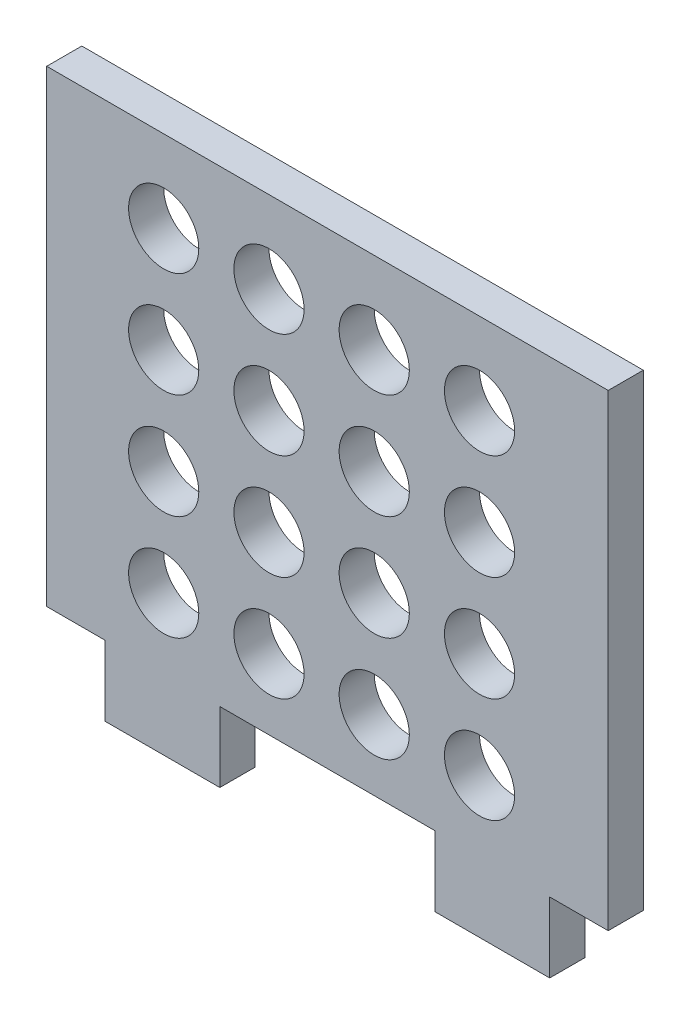
from build123d import *

# Parameters (mm, degrees)
ESQUISSE1_W             = 24
ESQUISSE1_H             = 20
BOSS_EXTRU_1_DEPTH      = 1.5
ESQUISSE2_W             = 4.9
ESQUISSE2_H             = 3
BOSS_EXTRU_2_DEPTH      = 1.5
ENL_V_MAT_EXTRU_1_REACH = 25.372
ESQUISSE3_R             = 1.5


with BuildPart() as part:
    # Esquisse1 → Boss.-Extru.1 (new body)
    with BuildSketch(Plane.XY):
        with Locations((0, 10)):
            Rectangle(ESQUISSE1_W, ESQUISSE1_H)
    extrude(amount=BOSS_EXTRU_1_DEPTH)

    # Esquisse2 → Boss.-Extru.2 (add)
    with BuildSketch(Plane.XY):
        with Locations((7.05, -1.5)):
            Rectangle(ESQUISSE2_W, ESQUISSE2_H)
        with Locations((-7.05, -1.5)):
            Rectangle(ESQUISSE2_W, ESQUISSE2_H)
    extrude(amount=BOSS_EXTRU_2_DEPTH)

    # Esquisse3 → Enlèv. mat.-Extru.1 (cut, up to next)
    with BuildSketch(Plane.XY.offset(1.5), mode=Mode.PRIVATE) as enl_v_mat_extru_1_sk1:
        with Locations((-7, 3)):
            Circle(ESQUISSE3_R)
    enl_v_mat_extru_1_tool1 = extrude(enl_v_mat_extru_1_sk1.sketch, amount=-ENL_V_MAT_EXTRU_1_REACH, mode=Mode.PRIVATE) & part.part
    # Esquisse3 → Enlèv. mat.-Extru.1 (cut, up to next)
    with BuildSketch(Plane.XY.offset(1.5), mode=Mode.PRIVATE) as enl_v_mat_extru_1_sk2:
        with Locations((-2.5, 3)):
            Circle(ESQUISSE3_R)
    enl_v_mat_extru_1_tool2 = extrude(enl_v_mat_extru_1_sk2.sketch, amount=-ENL_V_MAT_EXTRU_1_REACH, mode=Mode.PRIVATE) & part.part
    # Esquisse3 → Enlèv. mat.-Extru.1 (cut, up to next)
    with BuildSketch(Plane.XY.offset(1.5), mode=Mode.PRIVATE) as enl_v_mat_extru_1_sk3:
        with Locations((2, 3)):
            Circle(ESQUISSE3_R)
    enl_v_mat_extru_1_tool3 = extrude(enl_v_mat_extru_1_sk3.sketch, amount=-ENL_V_MAT_EXTRU_1_REACH, mode=Mode.PRIVATE) & part.part
    # Esquisse3 → Enlèv. mat.-Extru.1 (cut, up to next)
    with BuildSketch(Plane.XY.offset(1.5), mode=Mode.PRIVATE) as enl_v_mat_extru_1_sk4:
        with Locations((6.5, 3)):
            Circle(ESQUISSE3_R)
    enl_v_mat_extru_1_tool4 = extrude(enl_v_mat_extru_1_sk4.sketch, amount=-ENL_V_MAT_EXTRU_1_REACH, mode=Mode.PRIVATE) & part.part
    # Esquisse3 → Enlèv. mat.-Extru.1 (cut, up to next)
    with BuildSketch(Plane.XY.offset(1.5), mode=Mode.PRIVATE) as enl_v_mat_extru_1_sk5:
        with Locations((-2.5, 7.5)):
            Circle(ESQUISSE3_R)
    enl_v_mat_extru_1_tool5 = extrude(enl_v_mat_extru_1_sk5.sketch, amount=-ENL_V_MAT_EXTRU_1_REACH, mode=Mode.PRIVATE) & part.part
    # Esquisse3 → Enlèv. mat.-Extru.1 (cut, up to next)
    with BuildSketch(Plane.XY.offset(1.5), mode=Mode.PRIVATE) as enl_v_mat_extru_1_sk6:
        with Locations((2, 7.5)):
            Circle(ESQUISSE3_R)
    enl_v_mat_extru_1_tool6 = extrude(enl_v_mat_extru_1_sk6.sketch, amount=-ENL_V_MAT_EXTRU_1_REACH, mode=Mode.PRIVATE) & part.part
    # Esquisse3 → Enlèv. mat.-Extru.1 (cut, up to next)
    with BuildSketch(Plane.XY.offset(1.5), mode=Mode.PRIVATE) as enl_v_mat_extru_1_sk7:
        with Locations((6.5, 7.5)):
            Circle(ESQUISSE3_R)
    enl_v_mat_extru_1_tool7 = extrude(enl_v_mat_extru_1_sk7.sketch, amount=-ENL_V_MAT_EXTRU_1_REACH, mode=Mode.PRIVATE) & part.part
    # Esquisse3 → Enlèv. mat.-Extru.1 (cut, up to next)
    with BuildSketch(Plane.XY.offset(1.5), mode=Mode.PRIVATE) as enl_v_mat_extru_1_sk8:
        with Locations((-2.5, 12)):
            Circle(ESQUISSE3_R)
    enl_v_mat_extru_1_tool8 = extrude(enl_v_mat_extru_1_sk8.sketch, amount=-ENL_V_MAT_EXTRU_1_REACH, mode=Mode.PRIVATE) & part.part
    # Esquisse3 → Enlèv. mat.-Extru.1 (cut, up to next)
    with BuildSketch(Plane.XY.offset(1.5), mode=Mode.PRIVATE) as enl_v_mat_extru_1_sk9:
        with Locations((2, 12)):
            Circle(ESQUISSE3_R)
    enl_v_mat_extru_1_tool9 = extrude(enl_v_mat_extru_1_sk9.sketch, amount=-ENL_V_MAT_EXTRU_1_REACH, mode=Mode.PRIVATE) & part.part
    # Esquisse3 → Enlèv. mat.-Extru.1 (cut, up to next)
    with BuildSketch(Plane.XY.offset(1.5), mode=Mode.PRIVATE) as enl_v_mat_extru_1_sk10:
        with Locations((6.5, 12)):
            Circle(ESQUISSE3_R)
    enl_v_mat_extru_1_tool10 = extrude(enl_v_mat_extru_1_sk10.sketch, amount=-ENL_V_MAT_EXTRU_1_REACH, mode=Mode.PRIVATE) & part.part
    # Esquisse3 → Enlèv. mat.-Extru.1 (cut, up to next)
    with BuildSketch(Plane.XY.offset(1.5), mode=Mode.PRIVATE) as enl_v_mat_extru_1_sk11:
        with Locations((-2.5, 16.5)):
            Circle(ESQUISSE3_R)
    enl_v_mat_extru_1_tool11 = extrude(enl_v_mat_extru_1_sk11.sketch, amount=-ENL_V_MAT_EXTRU_1_REACH, mode=Mode.PRIVATE) & part.part
    # Esquisse3 → Enlèv. mat.-Extru.1 (cut, up to next)
    with BuildSketch(Plane.XY.offset(1.5), mode=Mode.PRIVATE) as enl_v_mat_extru_1_sk12:
        with Locations((2, 16.5)):
            Circle(ESQUISSE3_R)
    enl_v_mat_extru_1_tool12 = extrude(enl_v_mat_extru_1_sk12.sketch, amount=-ENL_V_MAT_EXTRU_1_REACH, mode=Mode.PRIVATE) & part.part
    # Esquisse3 → Enlèv. mat.-Extru.1 (cut, up to next)
    with BuildSketch(Plane.XY.offset(1.5), mode=Mode.PRIVATE) as enl_v_mat_extru_1_sk13:
        with Locations((6.5, 16.5)):
            Circle(ESQUISSE3_R)
    enl_v_mat_extru_1_tool13 = extrude(enl_v_mat_extru_1_sk13.sketch, amount=-ENL_V_MAT_EXTRU_1_REACH, mode=Mode.PRIVATE) & part.part
    # Esquisse3 → Enlèv. mat.-Extru.1 (cut, up to next)
    with BuildSketch(Plane.XY.offset(1.5), mode=Mode.PRIVATE) as enl_v_mat_extru_1_sk14:
        with Locations((-7, 7.5)):
            Circle(ESQUISSE3_R)
    enl_v_mat_extru_1_tool14 = extrude(enl_v_mat_extru_1_sk14.sketch, amount=-ENL_V_MAT_EXTRU_1_REACH, mode=Mode.PRIVATE) & part.part
    # Esquisse3 → Enlèv. mat.-Extru.1 (cut, up to next)
    with BuildSketch(Plane.XY.offset(1.5), mode=Mode.PRIVATE) as enl_v_mat_extru_1_sk15:
        with Locations((-7, 12)):
            Circle(ESQUISSE3_R)
    enl_v_mat_extru_1_tool15 = extrude(enl_v_mat_extru_1_sk15.sketch, amount=-ENL_V_MAT_EXTRU_1_REACH, mode=Mode.PRIVATE) & part.part
    # Esquisse3 → Enlèv. mat.-Extru.1 (cut, up to next)
    with BuildSketch(Plane.XY.offset(1.5), mode=Mode.PRIVATE) as enl_v_mat_extru_1_sk16:
        with Locations((-7, 16.5)):
            Circle(ESQUISSE3_R)
    enl_v_mat_extru_1_tool16 = extrude(enl_v_mat_extru_1_sk16.sketch, amount=-ENL_V_MAT_EXTRU_1_REACH, mode=Mode.PRIVATE) & part.part
    add(enl_v_mat_extru_1_tool1.solids().sort_by_distance((-7, 3, 1.5))[0], mode=Mode.SUBTRACT)
    add(enl_v_mat_extru_1_tool2.solids().sort_by_distance((-2.5, 3, 1.5))[0], mode=Mode.SUBTRACT)
    add(enl_v_mat_extru_1_tool3.solids().sort_by_distance((2, 3, 1.5))[0], mode=Mode.SUBTRACT)
    add(enl_v_mat_extru_1_tool4.solids().sort_by_distance((6.5, 3, 1.5))[0], mode=Mode.SUBTRACT)
    add(enl_v_mat_extru_1_tool5.solids().sort_by_distance((-2.5, 7.5, 1.5))[0], mode=Mode.SUBTRACT)
    add(enl_v_mat_extru_1_tool6.solids().sort_by_distance((2, 7.5, 1.5))[0], mode=Mode.SUBTRACT)
    add(enl_v_mat_extru_1_tool7.solids().sort_by_distance((6.5, 7.5, 1.5))[0], mode=Mode.SUBTRACT)
    add(enl_v_mat_extru_1_tool8.solids().sort_by_distance((-2.5, 12, 1.5))[0], mode=Mode.SUBTRACT)
    add(enl_v_mat_extru_1_tool9.solids().sort_by_distance((2, 12, 1.5))[0], mode=Mode.SUBTRACT)
    add(enl_v_mat_extru_1_tool10.solids().sort_by_distance((6.5, 12, 1.5))[0], mode=Mode.SUBTRACT)
    add(enl_v_mat_extru_1_tool11.solids().sort_by_distance((-2.5, 16.5, 1.5))[0], mode=Mode.SUBTRACT)
    add(enl_v_mat_extru_1_tool12.solids().sort_by_distance((2, 16.5, 1.5))[0], mode=Mode.SUBTRACT)
    add(enl_v_mat_extru_1_tool13.solids().sort_by_distance((6.5, 16.5, 1.5))[0], mode=Mode.SUBTRACT)
    add(enl_v_mat_extru_1_tool14.solids().sort_by_distance((-7, 7.5, 1.5))[0], mode=Mode.SUBTRACT)
    add(enl_v_mat_extru_1_tool15.solids().sort_by_distance((-7, 12, 1.5))[0], mode=Mode.SUBTRACT)
    add(enl_v_mat_extru_1_tool16.solids().sort_by_distance((-7, 16.5, 1.5))[0], mode=Mode.SUBTRACT)


solid = part.part
